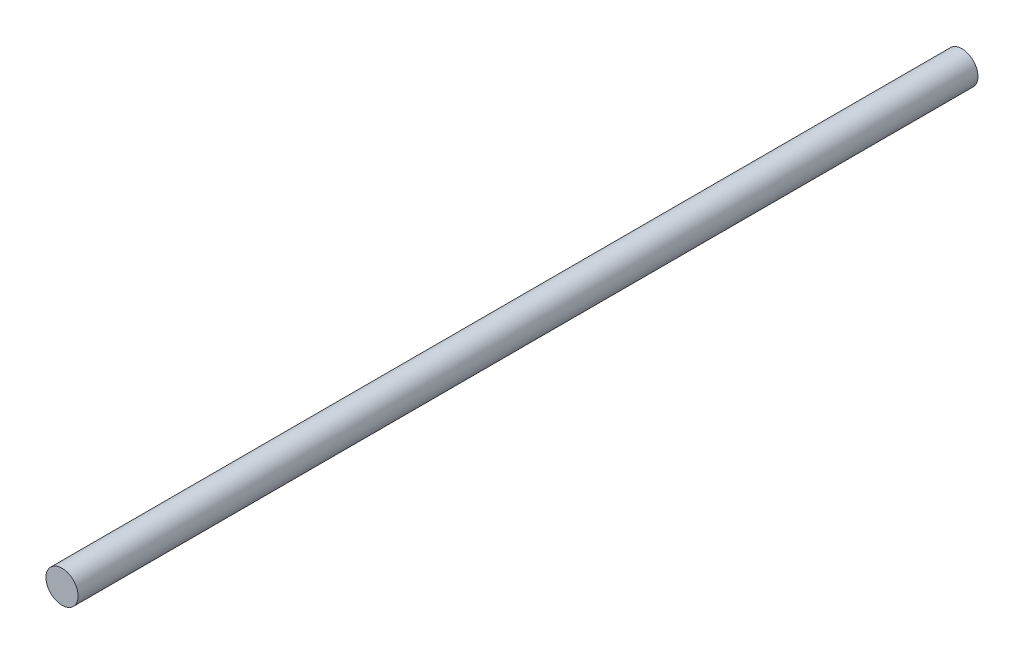
from build123d import *

# Parameters (mm, degrees)
SKETCH1_R           = 2.5
BOSS_EXTRUDE1_DEPTH = 140


with BuildPart() as part:
    # Sketch1 → Boss-Extrude1 (new body)
    with BuildSketch(Plane.XY):
        with Locations((-4.226562147, 0)):
            Circle(SKETCH1_R)
    extrude(amount=BOSS_EXTRUDE1_DEPTH)


solid = part.part
